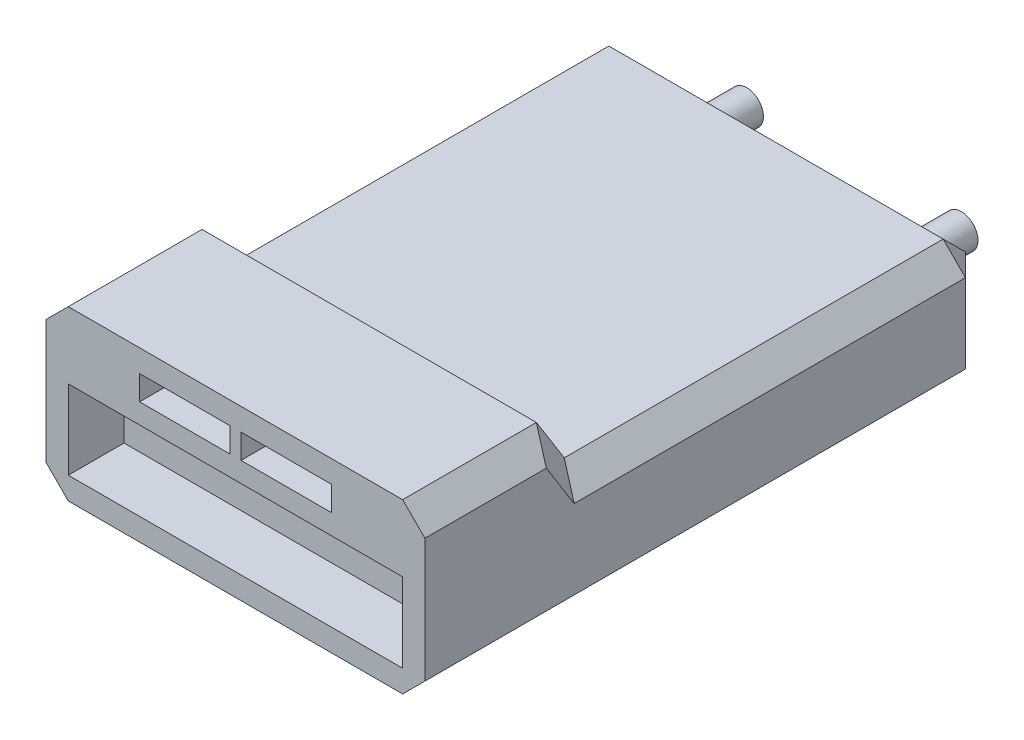
from build123d import *

# Parameters (mm, degrees)
BOSS_EXTRUDE1_DEPTH = 17
SKETCH2_R           = 1.5
BOSS_EXTRUDE2_DEPTH = 5
SKETCH3_W           = 30
SKETCH3_H           = 7.1
SKETCH3_W_2         = 8.1
SKETCH3_H_2         = 2.2
CUT_EXTRUDE1_DEPTH  = 5
CHAMFER1_SIZE       = 2


with BuildPart() as part:
    # Sketch1 → Boss-Extrude1 (new, symmetric)
    with BuildSketch(Plane(origin=(0, 0, 0), x_dir=(0, 0, -1), z_dir=(1, 0, 0))):
        Polygon((0, 0), (50.5, 0), (50.5, 11.1), (14.5, 11.1), (12, 15.1), (0, 15.1), align=None)
    extrude(amount=BOSS_EXTRUDE1_DEPTH, both=True)

    # Sketch2 → Boss-Extrude2 (add)
    with BuildSketch(Plane(origin=(0, 0, -50.5), x_dir=(-1, 0, 0), z_dir=(0, 0, -1))):
        with Locations(Location((9.625, 5.55, 0), (0, 0, 180))):
            Circle(SKETCH2_R)
        with Locations(Location((-9.625, 5.55, 0), (0, 0, 180))):
            Circle(SKETCH2_R)
    extrude(amount=BOSS_EXTRUDE2_DEPTH)

    # Sketch3 → Cut-Extrude1 (cut)
    with BuildSketch(Plane.XY):
        with Locations((0, 5.55)):
            Rectangle(SKETCH3_W, SKETCH3_H)
        with Locations((-4.55, 12)):
            Rectangle(SKETCH3_W_2, SKETCH3_H_2)
        with Locations((4.55, 12)):
            Rectangle(SKETCH3_W_2, SKETCH3_H_2)
    extrude(amount=-CUT_EXTRUDE1_DEPTH, mode=Mode.SUBTRACT)

    # Chamfer1
    chamfer1_edges = [part.edges().sort_by_distance(p)[0] for p in [
        (0, 11.1, -50.5),
        (0, 0, -50.5),
        (17, 5.55, -50.5),
        (17, 11.1, -32.5),
        (17, 13.1, -13.25),
        (17, 15.1, -6),
        (-17, 15.1, -6),
        (-17, 13.1, -13.25),
        (-17, 11.1, -32.5),
        (-17, 5.55, -50.5),
        (-17, 0, -25.25),
        (17, 0, -25.25),
    ]]
    chamfer(chamfer1_edges, length=CHAMFER1_SIZE)


solid = part.part
